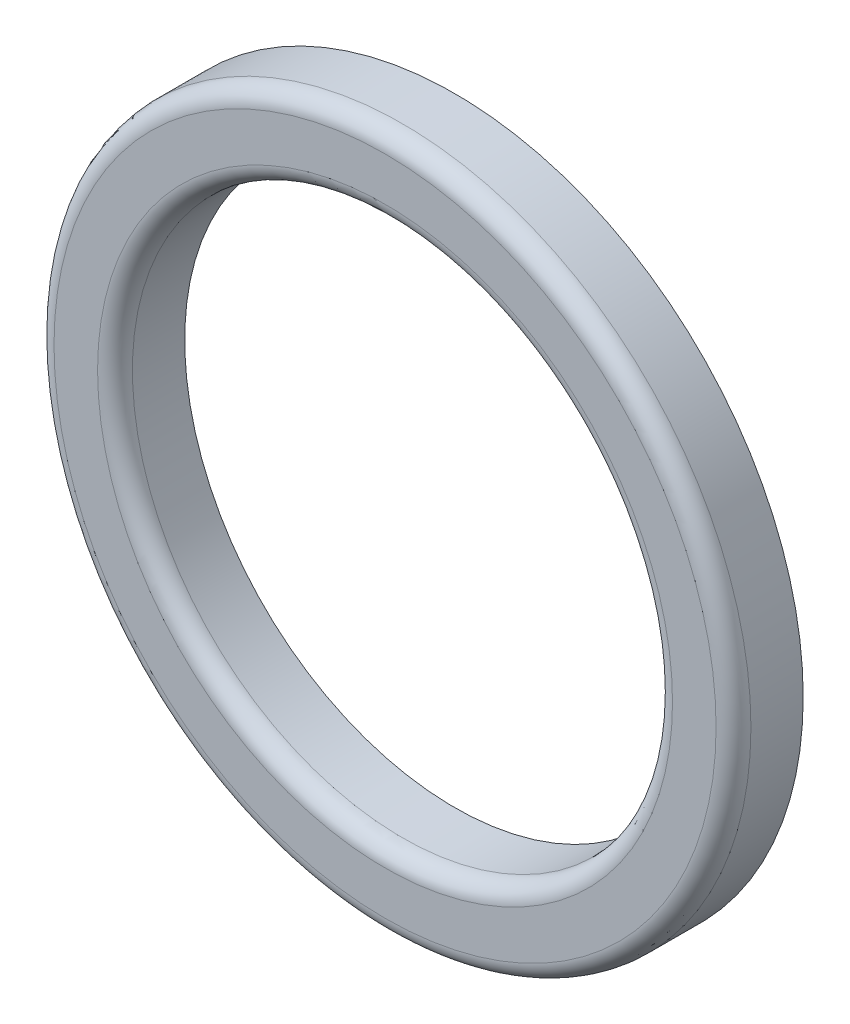
from build123d import *

# Parameters (mm, degrees)
SKICA1_R                = 10
SKICA1_R_2              = 7.75
P_IDAT_VYSUNUT_M1_DEPTH = 2
ZAOBLIT1_R              = 0.5


with BuildPart() as part:
    # Skica1 → Přidat vysunutím1 (new body)
    with BuildSketch(Plane.XY):
        Circle(SKICA1_R)
        Circle(SKICA1_R_2, mode=Mode.SUBTRACT)
    extrude(amount=P_IDAT_VYSUNUT_M1_DEPTH)

    # Zaoblit1
    zaoblit1_edges = [part.edges().sort_by_distance(p)[0] for p in [
        (-10, 0, 2),
        (-7.75, 0, 2),
    ]]
    fillet(zaoblit1_edges, radius=ZAOBLIT1_R)


solid = part.part
